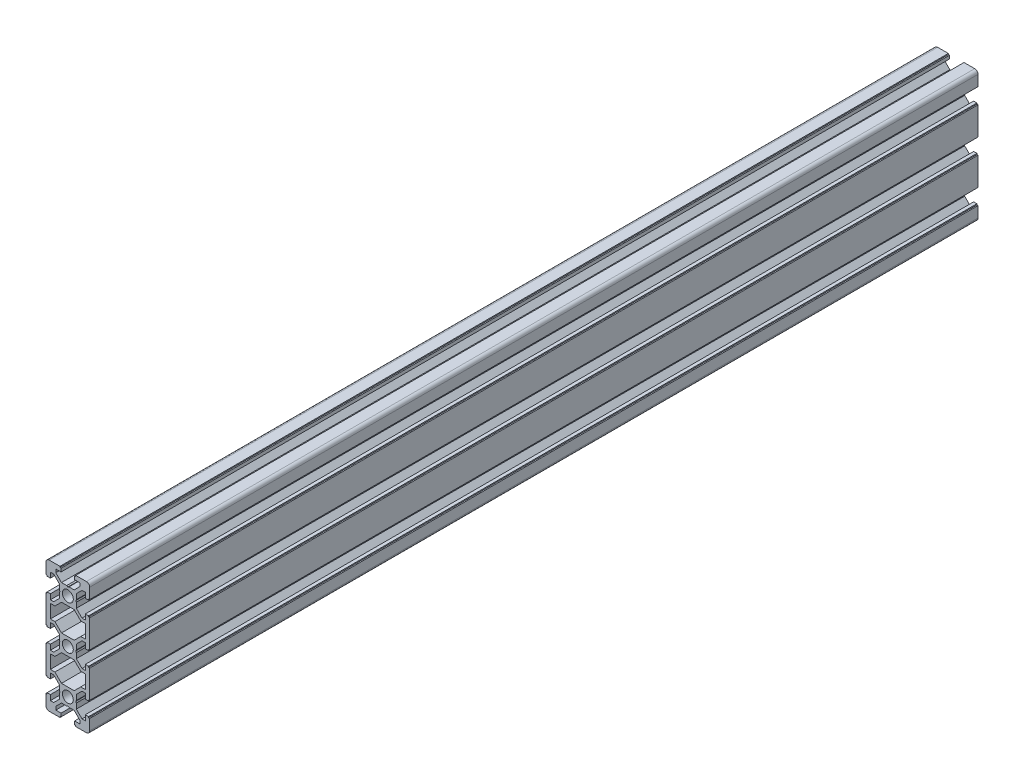
from build123d import *

# Parameters (mm, degrees)
SKETCH_28_R     = 2.5
EXTRUDE_1_DEPTH = 407


with BuildPart() as part:
    # 草图28 → 凸台-拉伸1 (new body)
    with BuildSketch(Plane.XY):
        with BuildLine():
            Line((9.5, 36.4), (9.5, 36.9))
            Line((9.5, 36.9), (8, 36.9))
            Line((8, 36.9), (8, 34.5))
            Line((8, 34.5), (6.489949494, 34.5))
            Line((6.489949494, 34.5), (3.9, 37.089949494))
            Line((3.9, 37.089949494), (3.9, 39.480384758))
            Line((3.9, 39.480384758), (3.6, 40))
            Line((3.6, 40), (3.9, 40.519615242))
            Line((3.9, 40.519615242), (3.9, 42.910050506))
            Line((3.9, 42.910050506), (6.489949494, 45.5))
            Line((6.489949494, 45.5), (8, 45.5))
            Line((8, 45.5), (8, 43.1))
            Line((8, 43.1), (9.5, 43.1))
            Line((9.5, 43.1), (9.5, 43.6))
            Line((9.5, 43.6), (10, 43.6))
            Line((10, 43.6), (10, 48.5))
            ThreePointArc((10, 48.5), (9.560660172, 49.560660172), (8.5, 50))
            Line((8.5, 50), (3.6, 50))
            Line((3.6, 50), (3.6, 49.5))
            Line((3.6, 49.5), (3.1, 49.5))
            Line((3.1, 49.5), (3.1, 48))
            Line((3.1, 48), (5.5, 48))
            Line((5.5, 48), (5.5, 46.489949494))
            Line((5.5, 46.489949494), (2.910050506, 43.9))
            Line((2.910050506, 43.9), (0.519615242, 43.9))
            Line((0.519615242, 43.9), (0, 43.6))
            Line((0, 43.6), (-0.519615242, 43.9))
            Line((-0.519615242, 43.9), (-2.910050506, 43.9))
            Line((-2.910050506, 43.9), (-5.5, 46.489949494))
            Line((-5.5, 46.489949494), (-5.5, 48))
            Line((-5.5, 48), (-3.1, 48))
            Line((-3.1, 48), (-3.1, 49.5))
            Line((-3.1, 49.5), (-3.6, 49.5))
            Line((-3.6, 49.5), (-3.6, 50))
            Line((-3.6, 50), (-8.5, 50))
            ThreePointArc((-8.5, 50), (-9.560660172, 49.560660172), (-10, 48.5))
            Line((-10, 48.5), (-10, 43.6))
            Line((-10, 43.6), (-9.5, 43.6))
            Line((-9.5, 43.6), (-9.5, 43.1))
            Line((-9.5, 43.1), (-8, 43.1))
            Line((-8, 43.1), (-8, 45.5))
            Line((-8, 45.5), (-6.489949494, 45.5))
            Line((-6.489949494, 45.5), (-3.9, 42.910050506))
            Line((-3.9, 42.910050506), (-3.9, 40.519615242))
            Line((-3.9, 40.519615242), (-3.6, 40))
            Line((-3.6, 40), (-3.9, 39.480384758))
            Line((-3.9, 39.480384758), (-3.9, 37.089949494))
            Line((-3.9, 37.089949494), (-6.489949494, 34.5))
            Line((-6.489949494, 34.5), (-8, 34.5))
            Line((-8, 34.5), (-8, 36.9))
            Line((-8, 36.9), (-9.5, 36.9))
            Line((-9.5, 36.9), (-9.5, 36.4))
            Line((-9.5, 36.4), (-10, 36.4))
            Line((-10, 36.4), (-10, 23.6))
            Line((-10, 23.6), (-9.5, 23.6))
            Line((-9.5, 23.6), (-9.5, 23.1))
            Line((-9.5, 23.1), (-8, 23.1))
            Line((-8, 23.1), (-8, 25.5))
            Line((-8, 25.5), (-6.489949494, 25.5))
            Line((-6.489949494, 25.5), (-3.9, 22.910050506))
            Line((-3.9, 22.910050506), (-3.9, 20.519615242))
            Line((-3.9, 20.519615242), (-3.6, 20))
            Line((-3.6, 20), (-3.9, 19.480384758))
            Line((-3.9, 19.480384758), (-3.9, 17.089949494))
            Line((-3.9, 17.089949494), (-6.489949494, 14.5))
            Line((-6.489949494, 14.5), (-8, 14.5))
            Line((-8, 14.5), (-8, 16.9))
            Line((-8, 16.9), (-9.5, 16.9))
            Line((-9.5, 16.9), (-9.5, 16.4))
            Line((-9.5, 16.4), (-10, 16.4))
            Line((-10, 16.4), (-10, 3.6))
            Line((-10, 3.6), (-9.5, 3.6))
            Line((-9.5, 3.6), (-9.5, 3.1))
            Line((-9.5, 3.1), (-8, 3.1))
            Line((-8, 3.1), (-8, 5.5))
            Line((-8, 5.5), (-6.489949494, 5.5))
            Line((-6.489949494, 5.5), (-3.9, 2.910050506))
            Line((-3.9, 2.910050506), (-3.9, 0.519615242))
            Line((-3.9, 0.519615242), (-3.6, 0))
            Line((-3.6, 0), (-3.9, -0.519615242))
            Line((-3.9, -0.519615242), (-3.9, -2.910050506))
            Line((-3.9, -2.910050506), (-6.489949494, -5.5))
            Line((-6.489949494, -5.5), (-8, -5.5))
            Line((-8, -5.5), (-8, -3.1))
            Line((-8, -3.1), (-9.5, -3.1))
            Line((-9.5, -3.1), (-9.5, -3.6))
            Line((-9.5, -3.6), (-10, -3.6))
            Line((-10, -3.6), (-10, -8.5))
            ThreePointArc((-10, -8.5), (-9.560660172, -9.560660172), (-8.5, -10))
            Line((-8.5, -10), (-3.6, -10))
            Line((-3.6, -10), (-3.6, -9.5))
            Line((-3.6, -9.5), (-3.1, -9.5))
            Line((-3.1, -9.5), (-3.1, -8))
            Line((-3.1, -8), (-5.5, -8))
            Line((-5.5, -8), (-5.5, -6.489949494))
            Line((-5.5, -6.489949494), (-2.910050506, -3.9))
            Line((-2.910050506, -3.9), (-0.519615242, -3.9))
            Line((-0.519615242, -3.9), (0, -3.6))
            Line((0, -3.6), (0.519615242, -3.9))
            Line((0.519615242, -3.9), (2.910050506, -3.9))
            Line((2.910050506, -3.9), (5.5, -6.489949494))
            Line((5.5, -6.489949494), (5.5, -8))
            Line((5.5, -8), (3.1, -8))
            Line((3.1, -8), (3.1, -9.5))
            Line((3.1, -9.5), (3.6, -9.5))
            Line((3.6, -9.5), (3.6, -10))
            Line((3.6, -10), (8.5, -10))
            ThreePointArc((8.5, -10), (9.560660172, -9.560660172), (10, -8.5))
            Line((10, -8.5), (10, -3.6))
            Line((10, -3.6), (9.5, -3.6))
            Line((9.5, -3.6), (9.5, -3.1))
            Line((9.5, -3.1), (8, -3.1))
            Line((8, -3.1), (8, -5.5))
            Line((8, -5.5), (6.489949494, -5.5))
            Line((6.489949494, -5.5), (3.9, -2.910050506))
            Line((3.9, -2.910050506), (3.9, -0.519615242))
            Line((3.9, -0.519615242), (3.6, 0))
            Line((3.6, 0), (3.9, 0.519615242))
            Line((3.9, 0.519615242), (3.9, 2.910050506))
            Line((3.9, 2.910050506), (6.489949494, 5.5))
            Line((6.489949494, 5.5), (8, 5.5))
            Line((8, 5.5), (8, 3.1))
            Line((8, 3.1), (9.5, 3.1))
            Line((9.5, 3.1), (9.5, 3.6))
            Line((9.5, 3.6), (10, 3.6))
            Line((10, 3.6), (10, 16.4))
            Line((10, 16.4), (9.5, 16.4))
            Line((9.5, 16.4), (9.5, 16.9))
            Line((9.5, 16.9), (8, 16.9))
            Line((8, 16.9), (8, 14.5))
            Line((8, 14.5), (6.489949494, 14.5))
            Line((6.489949494, 14.5), (3.9, 17.089949494))
            Line((3.9, 17.089949494), (3.9, 19.480384758))
            Line((3.9, 19.480384758), (3.6, 20))
            Line((3.6, 20), (3.9, 20.519615242))
            Line((3.9, 20.519615242), (3.9, 22.910050506))
            Line((3.9, 22.910050506), (6.489949494, 25.5))
            Line((6.489949494, 25.5), (8, 25.5))
            Line((8, 25.5), (8, 23.1))
            Line((8, 23.1), (9.5, 23.1))
            Line((9.5, 23.1), (9.5, 23.6))
            Line((9.5, 23.6), (10, 23.6))
            Line((10, 23.6), (10, 36.4))
            Line((10, 36.4), (9.5, 36.4))
        make_face()
        Circle(SKETCH_28_R, mode=Mode.SUBTRACT)
        with Locations((0, 20)):
            Circle(SKETCH_28_R, mode=Mode.SUBTRACT)
        with Locations((0, 40)):
            Circle(SKETCH_28_R, mode=Mode.SUBTRACT)
        Polygon((2.910050506, 16.1), (5.910050506, 13.1), (8, 13.1), (8, 6.9), (5.910050506, 6.9), (2.910050506, 3.9), (-2.910050506, 3.9), (-5.910050506, 6.9), (-8, 6.9), (-8, 13.1), (-5.910050506, 13.1), (-2.910050506, 16.1), align=None, mode=Mode.SUBTRACT)
        Polygon((5.910050506, 26.9), (2.910050506, 23.9), (-2.910050506, 23.9), (-5.910050506, 26.9), (-8, 26.9), (-8, 33.1), (-5.910050506, 33.1), (-2.910050506, 36.1), (2.910050506, 36.1), (5.910050506, 33.1), (8, 33.1), (8, 26.9), align=None, mode=Mode.SUBTRACT)
    extrude(amount=EXTRUDE_1_DEPTH)


solid = part.part
